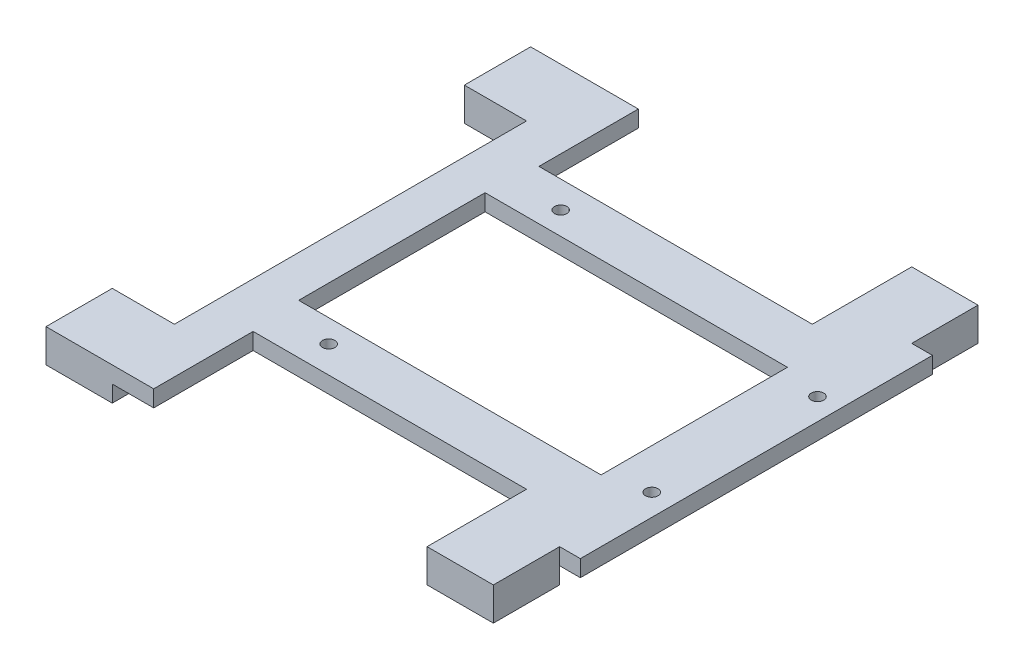
from build123d import *

# Parameters (mm, degrees)
SKETCH1_W                       = 113
SKETCH1_H                       = 85
BOSS_EXTRUDE1_DEPTH             = 4
SKETCH2_R                       = 1.5
CUT_EXTRUDE1_DEPTH              = 71.813134375
BOSS_EXTRUDE3_REACH             = 72.813
SKETCH4_W                       = 16
SKETCH4_H                       = 16
BOSS_EXTRUDE3_DIRECTION_2_DEPTH = 1
SKETCH10_W                      = 10
SKETCH10_H                      = 16
BOSS_EXTRUDE6_DEPTH             = 4
SKETCH6_W                       = 73
SKETCH6_H                       = 45
SKETCH6_W_2                     = 15
SKETCH6_H_2                     = 85
SKETCH6_W_3                     = 66
SKETCH6_H_3                     = 8
CUT_EXTRUDE2_DEPTH              = 82.483127088
SKETCH8_R                       = 6.1
CUT_EXTRUDE3_DEPTH              = 3.2
SKETCH9_W                       = 16
SKETCH9_H                       = 16
SKETCH9_W_2                     = 14
SKETCH9_H_2                     = 14
BOSS_EXTRUDE5_DEPTH             = 3
FILLET1_R                       = 0.2


with BuildPart() as part:
    # Sketch1 → Boss-Extrude1 (new body)
    with BuildSketch(Plane(origin=(0, 0, 0), x_dir=(1, 0, 0), z_dir=(0, 1, 0))):
        Rectangle(SKETCH1_W, SKETCH1_H)
    extrude(amount=BOSS_EXTRUDE1_DEPTH)

    # Sketch2 → Cut-Extrude1 (cut, through all)
    with BuildSketch(Plane(origin=(0, 4, 0), x_dir=(1, 0, 0), z_dir=(0, 1, 0))):
        with Locations(Location((-18.75, 28, 0), (0, 0, 270))):
            Circle(SKETCH2_R)
        with Locations(Location((-18.75, -28, 0), (0, 0, 270))):
            Circle(SKETCH2_R)
        with Locations(Location((51.25, -20, 0), (0, 0, 270))):
            Circle(SKETCH2_R)
        with Locations(Location((51.25, 20, 0), (0, 0, 270))):
            Circle(SKETCH2_R)
    extrude(amount=-CUT_EXTRUDE1_DEPTH, mode=Mode.SUBTRACT)

    # Boss-Extrude3: up to this face of the body (flat: up to its plane)
    boss_extrude3_end = Plane(part.part.faces().sort_by_distance((-0.047976515, 4, 0))[0])
    # Sketch4 → Boss-Extrude3 (add, up to the picked face)
    with BuildSketch(Plane.XZ, mode=Mode.PRIVATE) as boss_extrude3_sk1:
        with Locations((-48.5, 50.5)):
            Rectangle(SKETCH4_W, SKETCH4_H)
    boss_extrude3_tool1 = split(extrude(boss_extrude3_sk1.sketch, amount=-BOSS_EXTRUDE3_REACH, mode=Mode.PRIVATE), bisect_by=boss_extrude3_end, keep=Keep.BOTH, mode=Mode.PRIVATE)
    # Sketch4 → Boss-Extrude3 (add, up to the picked face)
    with BuildSketch(Plane.XZ, mode=Mode.PRIVATE) as boss_extrude3_sk2:
        with Locations((43.5, 50.5)):
            Rectangle(SKETCH4_W, SKETCH4_H)
    boss_extrude3_tool2 = split(extrude(boss_extrude3_sk2.sketch, amount=-BOSS_EXTRUDE3_REACH, mode=Mode.PRIVATE), bisect_by=boss_extrude3_end, keep=Keep.BOTH, mode=Mode.PRIVATE)
    # Sketch4 → Boss-Extrude3 (add, up to the picked face)
    with BuildSketch(Plane.XZ, mode=Mode.PRIVATE) as boss_extrude3_sk3:
        with Locations((43.5, -50.5)):
            Rectangle(SKETCH4_W, SKETCH4_H)
    boss_extrude3_tool3 = split(extrude(boss_extrude3_sk3.sketch, amount=-BOSS_EXTRUDE3_REACH, mode=Mode.PRIVATE), bisect_by=boss_extrude3_end, keep=Keep.BOTH, mode=Mode.PRIVATE)
    # Sketch4 → Boss-Extrude3 (add, up to the picked face)
    with BuildSketch(Plane.XZ, mode=Mode.PRIVATE) as boss_extrude3_sk4:
        with Locations((-48.5, -50.5)):
            Rectangle(SKETCH4_W, SKETCH4_H)
    boss_extrude3_tool4 = split(extrude(boss_extrude3_sk4.sketch, amount=-BOSS_EXTRUDE3_REACH, mode=Mode.PRIVATE), bisect_by=boss_extrude3_end, keep=Keep.BOTH, mode=Mode.PRIVATE)
    add(boss_extrude3_tool1.solids().sort_by(Axis((-48.5, 0, 50.5), (0, 1, 0)))[0])
    add(boss_extrude3_tool2.solids().sort_by(Axis((43.5, 0, 50.5), (0, 1, 0)))[0])
    add(boss_extrude3_tool3.solids().sort_by(Axis((43.5, 0, -50.5), (0, 1, 0)))[0])
    add(boss_extrude3_tool4.solids().sort_by(Axis((-48.5, 0, -50.5), (0, 1, 0)))[0])

    # Sketch4 → Boss-Extrude3 direction 2 (add)
    with BuildSketch(Plane.XZ):
        with Locations((-48.5, 50.5)):
            Rectangle(SKETCH4_W, SKETCH4_H)
        with Locations((43.5, 50.5)):
            Rectangle(SKETCH4_W, SKETCH4_H)
        with Locations((43.5, -50.5)):
            Rectangle(SKETCH4_W, SKETCH4_H)
        with Locations((-48.5, -50.5)):
            Rectangle(SKETCH4_W, SKETCH4_H)
    extrude(amount=BOSS_EXTRUDE3_DIRECTION_2_DEPTH)

    # Sketch10 → Boss-Extrude6 (add)
    with BuildSketch(Plane(origin=(0, 4, 0), x_dir=(1, 0, 0), z_dir=(0, 1, 0))):
        with Locations((-35.5, -50.5)):
            Rectangle(SKETCH10_W, SKETCH10_H)
        with Locations((-35.5, 50.5)):
            Rectangle(SKETCH10_W, SKETCH10_H)
    extrude(amount=-BOSS_EXTRUDE6_DEPTH)

    # Sketch6 → Cut-Extrude2 (cut, through all)
    with BuildSketch(Plane(origin=(0, 4, 0), x_dir=(1, 0, 0), z_dir=(0, 1, 0))):
        with Locations((5, 0)):
            Rectangle(SKETCH6_W, SKETCH6_H)
        with Locations((-49, 0)):
            Rectangle(SKETCH6_W_2, SKETCH6_H_2)
        with Locations((2.5, 38.5)):
            Rectangle(SKETCH6_W_3, SKETCH6_H_3)
        with Locations((2.5, -38.5)):
            Rectangle(SKETCH6_W_3, SKETCH6_H_3)
    extrude(amount=-CUT_EXTRUDE2_DEPTH, mode=Mode.SUBTRACT)

    # Sketch8 → Cut-Extrude3 (cut)
    with BuildSketch(Plane.XZ.offset(1)):
        with Locations(Location((-48.5, 50.5, 0), (0, 0, 270))):
            Circle(SKETCH8_R)
        with Locations(Location((43.5, 50.5, 0), (0, 0, 270))):
            Circle(SKETCH8_R)
        with Locations(Location((43.5, -50.5, 0), (0, 0, 90))):
            Circle(SKETCH8_R)
        with Locations(Location((-48.5, -50.5, 0), (0, 0, 90))):
            Circle(SKETCH8_R)
    extrude(amount=-CUT_EXTRUDE3_DEPTH, mode=Mode.SUBTRACT)

    # Sketch9 → Boss-Extrude5 (add)
    # profile 1 of 4: a face of its own
    with BuildSketch(Plane.XZ.offset(1)):
        with Locations((-48.5, 50.5)):
            Rectangle(SKETCH9_W, SKETCH9_H)
        with Locations((-48.5, 50.5)):
            Rectangle(SKETCH9_W_2, SKETCH9_H_2, mode=Mode.SUBTRACT)
    # profile 2 of 4: a face of its own
    with BuildSketch(Plane.XZ.offset(1)):
        with Locations((43.5, 50.5)):
            Rectangle(SKETCH9_W, SKETCH9_H)
        with Locations((43.5, 50.5)):
            Rectangle(SKETCH9_W_2, SKETCH9_H_2, mode=Mode.SUBTRACT)
    # profile 3 of 4: a face of its own
    with BuildSketch(Plane.XZ.offset(1)):
        with Locations((43.5, -50.5)):
            Rectangle(SKETCH9_W, SKETCH9_H)
        with Locations((43.5, -50.5)):
            Rectangle(SKETCH9_W_2, SKETCH9_H_2, mode=Mode.SUBTRACT)
    # profile 4 of 4: a face of its own
    with BuildSketch(Plane.XZ.offset(1)):
        with Locations((-48.5, -50.5)):
            Rectangle(SKETCH9_W, SKETCH9_H)
        with Locations((-48.5, -50.5)):
            Rectangle(SKETCH9_W_2, SKETCH9_H_2, mode=Mode.SUBTRACT)
    extrude(amount=BOSS_EXTRUDE5_DEPTH)

    # Fillet1
    fillet1_edges = [part.edges().sort_by_distance(p)[0] for p in [
        (-48.5, -1, -56.6),
        (43.5, -1, -56.6),
        (43.5, -1, 56.6),
        (-48.5, -1, 56.6),
    ]]
    fillet(fillet1_edges, radius=FILLET1_R)


solid = part.part
